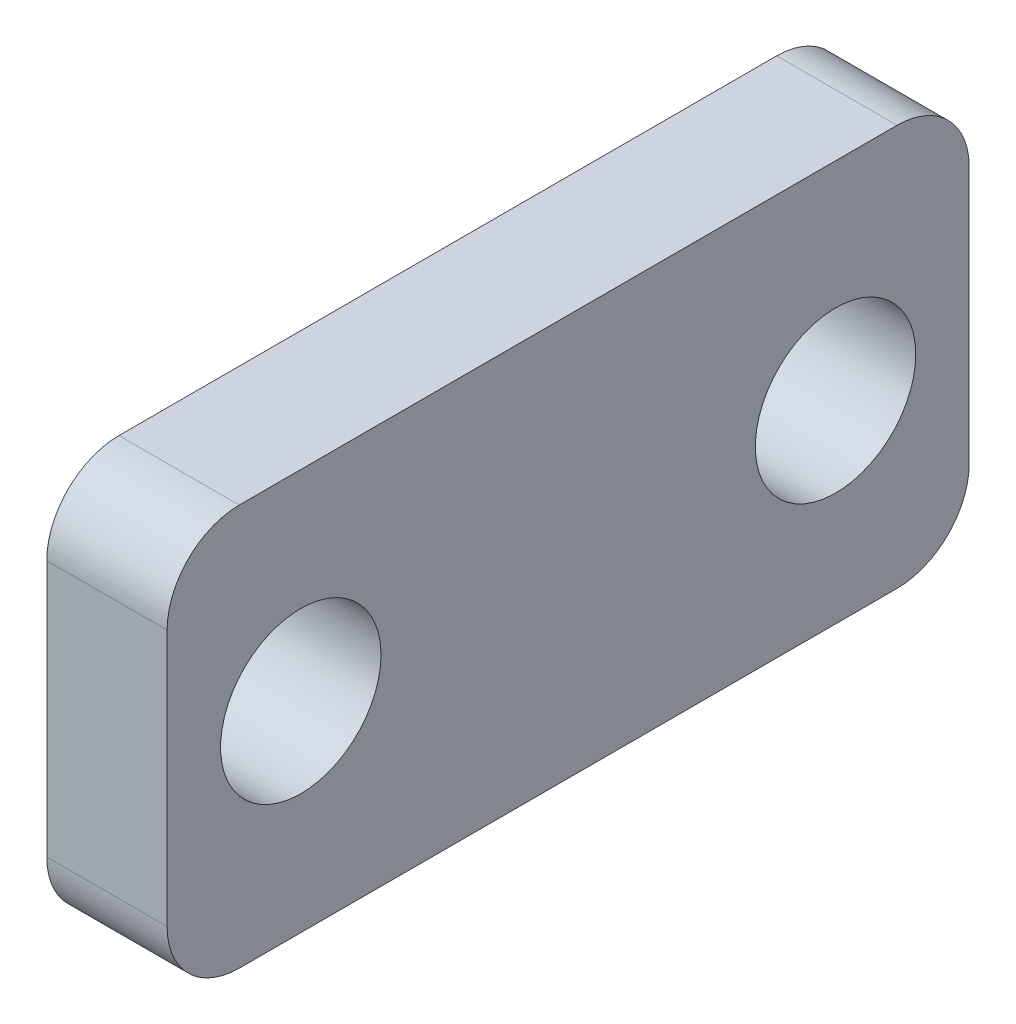
from build123d import *

# Parameters (mm, degrees)
Y_KSEKLIK_EKSTR_ZYON1_DEPTH = 45
IZIM2_R                     = 30
KES_EKSTR_ZYON2_DEPTH       = 45


with BuildPart() as part:
    # Çizim1 → Yükseklik-Ekstrüzyon1 (new body)
    with BuildSketch(Plane(origin=(0, 0, 0), x_dir=(0, 0, -1), z_dir=(1, 0, 0))):
        with BuildLine():
            Line((-123, 75), (123, 75))
            ThreePointArc((123, 75), (142.091883092, 67.091883092), (150, 48))
            Line((150, 48), (150, -48))
            ThreePointArc((150, -48), (142.091883092, -67.091883092), (123, -75))
            Line((123, -75), (-123, -75))
            ThreePointArc((-123, -75), (-142.091883092, -67.091883092), (-150, -48))
            Line((-150, -48), (-150, 48))
            ThreePointArc((-150, 48), (-142.091883092, 67.091883092), (-123, 75))
        make_face()
    extrude(amount=Y_KSEKLIK_EKSTR_ZYON1_DEPTH)

    # Çizim2 → Kes-Ekstrüzyon2 (cut)
    with BuildSketch(Plane(origin=(45, 0, 0), x_dir=(0, 0, -1), z_dir=(1, 0, 0))):
        with Locations((100, -2.634150603)):
            Circle(IZIM2_R)
        with Locations((-100, 0)):
            Circle(IZIM2_R)
    extrude(amount=-KES_EKSTR_ZYON2_DEPTH, mode=Mode.SUBTRACT)


solid = part.part
